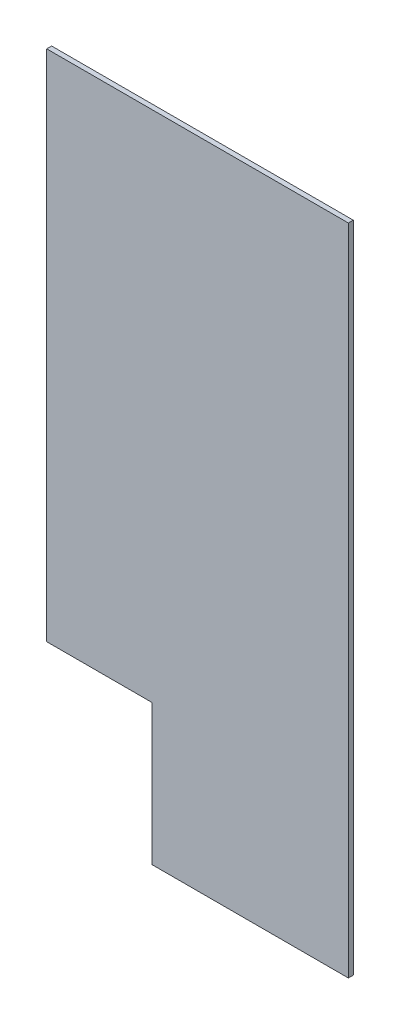
from build123d import *

# Parameters (mm, degrees)
SKETCH_1_W      = 245.98517055
SKETCH_1_H      = 4
EXTRUDE_1_DEPTH = 418.713673317
SKETCH_2_W      = 160
SKETCH_2_H      = 4
EXTRUDE_2_DEPTH = 114.5


with BuildPart() as part:
    # Эскиз1 → Вытянуть1 (new body)
    with BuildSketch(Plane(origin=(0, 0, 0), x_dir=(1, 0, 0), z_dir=(0, 1, 0))):
        with Locations((122.992585275, -2)):
            Rectangle(SKETCH_1_W, SKETCH_1_H)
    extrude(amount=EXTRUDE_1_DEPTH)

    # Эскиз2 → Вытянуть2 (add)
    with BuildSketch(Plane.XZ):
        with Locations((165.98517055, 2)):
            Rectangle(SKETCH_2_W, SKETCH_2_H)
    extrude(amount=EXTRUDE_2_DEPTH)


solid = part.part
